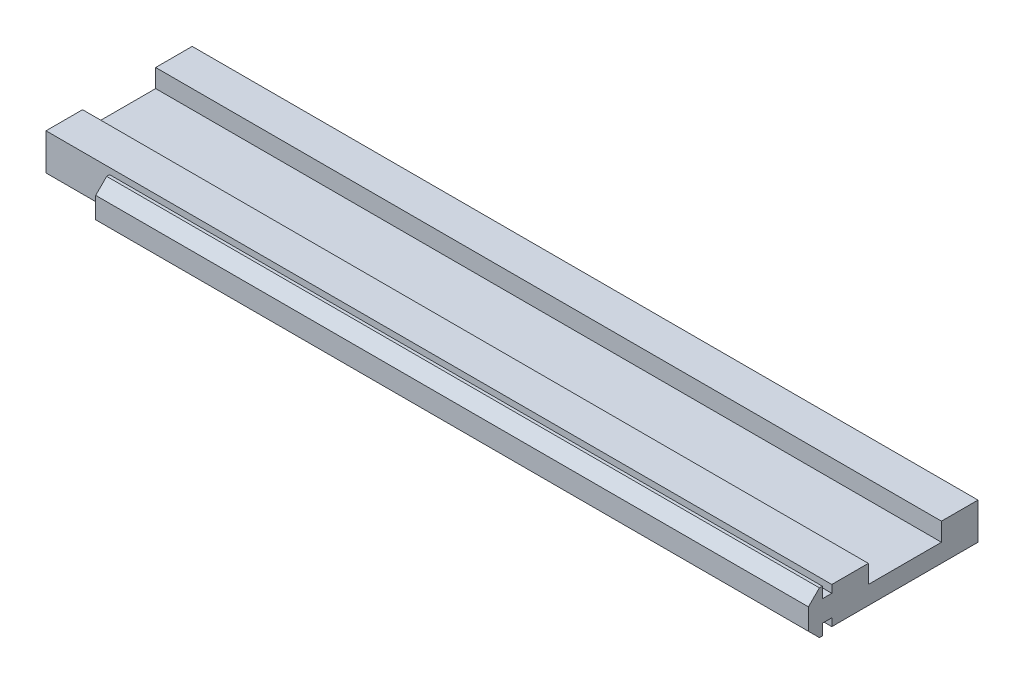
from build123d import *

# Parameters (mm, degrees)
SKETCH1_R           = 2.1
BOSS_EXTRUDE1_DEPTH = 65
SKETCH84_W          = 0.3
SKETCH84_H          = 5.4
BOSS_EXTRUDE6_DEPTH = 430
SKETCH85_W          = 26.589814492
SKETCH85_H          = 26.977421118
CUT_EXTRUDE59_DEPTH = 434.070721707
SKETCH86_W          = 10.5
SKETCH86_H          = 16.670499862
CUT_EXTRUDE60_DEPTH = 20
BOSS_EXTRUDE7_DEPTH = 430
SKETCH88_W          = 50.836385829
SKETCH88_H          = 23.143723533
CUT_EXTRUDE61_DEPTH = 452.123510754
SKETCH89_W          = 10.587528554
SKETCH89_H          = 18.486902418
CUT_EXTRUDE62_DEPTH = 20
SKETCH90_W          = 68.779191088
SKETCH90_H          = 30.058280779
CUT_EXTRUDE63_DEPTH = 215
BOSS_EXTRUDE8_DEPTH = 195


with BuildPart() as part:
    # Sketch1 → Boss-Extrude1 (new body)
    with BuildSketch(Plane(origin=(0, 0, 0), x_dir=(0, 0, -1), z_dir=(1, 0, 0))):
        with BuildLine():
            Line((-10, 9), (-10, 3))
            Line((-10, 3), (-8, 3))
            Line((-8, 3), (-8, 6))
            Line((-8, 6), (-7.060660172, 6))
            Line((-7.060660172, 6), (-4, 2.939339828))
            Line((-4, 2.939339828), (-4, -2.939339828))
            Line((-4, -2.939339828), (-7.060660172, -6))
            Line((-7.060660172, -6), (-8, -6))
            Line((-8, -6), (-8, -3))
            Line((-8, -3), (-10, -3))
            Line((-10, -3), (-10, -9))
            ThreePointArc((-10, -9), (-9.707106781, -9.707106781), (-9, -10))
            Line((-9, -10), (-3, -10))
            Line((-3, -10), (-3, -8))
            Line((-3, -8), (-6, -8))
            Line((-6, -8), (-6, -7.060660172))
            Line((-6, -7.060660172), (-2.939339828, -4))
            Line((-2.939339828, -4), (2.939339828, -4))
            Line((2.939339828, -4), (6, -7.060660172))
            Line((6, -7.060660172), (6, -8))
            Line((6, -8), (3, -8))
            Line((3, -8), (3, -10))
            Line((3, -10), (9, -10))
            ThreePointArc((9, -10), (9.707106781, -9.707106781), (10, -9))
            Line((10, -9), (10, -3))
            Line((10, -3), (8, -3))
            Line((8, -3), (8, -6))
            Line((8, -6), (7.060660172, -6))
            Line((7.060660172, -6), (4, -2.939339828))
            Line((4, -2.939339828), (4, 2.939339828))
            Line((4, 2.939339828), (7.060660172, 6))
            Line((7.060660172, 6), (8, 6))
            Line((8, 6), (8, 3))
            Line((8, 3), (10, 3))
            Line((10, 3), (10, 9))
            ThreePointArc((10, 9), (9.707106781, 9.707106781), (9, 10))
            Line((9, 10), (3, 10))
            Line((3, 10), (3, 8))
            Line((3, 8), (6, 8))
            Line((6, 8), (6, 7.060660172))
            Line((6, 7.060660172), (2.939339828, 4))
            Line((2.939339828, 4), (-2.939339828, 4))
            Line((-2.939339828, 4), (-6, 7.060660172))
            Line((-6, 7.060660172), (-6, 8))
            Line((-6, 8), (-3, 8))
            Line((-3, 8), (-3, 10))
            Line((-3, 10), (-9, 10))
            ThreePointArc((-9, 10), (-9.707106781, 9.707106781), (-10, 9))
        make_face()
        Circle(SKETCH1_R, mode=Mode.SUBTRACT)
    extrude(amount=BOSS_EXTRUDE1_DEPTH)

    # Sketch85 → Cut-Extrude59 (cut, through all)
    with BuildSketch(Plane(origin=(65, 0, 0), x_dir=(0, 0, -1), z_dir=(1, 0, 0))):
        with Locations((1.176321583, -0.814927094)):
            Rectangle(SKETCH85_W, SKETCH85_H)
    extrude(amount=-CUT_EXTRUDE59_DEPTH, mode=Mode.SUBTRACT)


with BuildPart() as body_2:
    # Sketch84 → Boss-Extrude6 (new body)
    with BuildSketch(Plane(origin=(65, 0, 0), x_dir=(0, 0, -1), z_dir=(1, 0, 0))):
        Polygon((-10, -2.7), (-10, 2.7), (-10.5, 2.7), (-10.5, 5), (-20.5, 5), (-20.5, 0), (-40.5, 0), (-40.5, 5), (-50.5, 5), (-50.5, -5), (-10.5, -5), (-10.5, -2.7), align=None)
        Polygon((-7.18492424, 5.7), (-4.3, 2.81507576), (-4.3, -2.81507576), (-7.18492424, -5.7), (-7.7, -5.7), (-7.7, -2.7), (-9.7, -2.7), (-9.7, 2.7), (-7.7, 2.7), (-7.7, 5.7), align=None)
        with Locations((-9.85, 0)):
            Rectangle(SKETCH84_W, SKETCH84_H)
    extrude(amount=BOSS_EXTRUDE6_DEPTH)

    # Sketch86 → Cut-Extrude60 (cut)
    with BuildSketch(Plane.ZY.offset(-65)):
        with Locations((5.25, -0.117074477)):
            Rectangle(SKETCH86_W, SKETCH86_H)
    extrude(amount=-CUT_EXTRUDE60_DEPTH, mode=Mode.SUBTRACT)

    # Sketch88 → Cut-Extrude61 (cut, through all)
    with BuildSketch(Plane(origin=(495, 0, 0), x_dir=(0, 0, -1), z_dir=(1, 0, 0))):
        with Locations((-27.072054747, -2.705254768)):
            Rectangle(SKETCH88_W, SKETCH88_H)
    extrude(amount=-CUT_EXTRUDE61_DEPTH, mode=Mode.SUBTRACT)


with BuildPart() as body_2_2:
    # Sketch87 → Boss-Extrude7 (new body)
    with BuildSketch(Plane(origin=(495, 0, 0), x_dir=(0, 0, -1), z_dir=(1, 0, 0))):
        Polygon((-90.108224091, 5), (-90.108224091, -5), (-130.108224091, -5), (-130.108224091, -2.7), (-132.908224091, -2.7), (-132.908224091, -5.7), (-133.42329985, -5.7), (-136.308224091, -2.81507576), (-136.308224091, 2.81507576), (-133.42329985, 5.7), (-132.908224091, 5.7), (-132.908224091, 2.7), (-130.108224091, 2.7), (-130.108224091, 5), (-120.108224091, 5), (-120.108224091, 0), (-100.108224091, 0), (-100.108224091, 5), align=None)
    extrude(amount=BOSS_EXTRUDE7_DEPTH)

    # Sketch89 → Cut-Extrude62 (cut)
    with BuildSketch(Plane.ZY.offset(-495)):
        with Locations((135.401988368, 0.001330813)):
            Rectangle(SKETCH89_W, SKETCH89_H)
    extrude(amount=-CUT_EXTRUDE62_DEPTH, mode=Mode.SUBTRACT)

    # Sketch90 → Cut-Extrude63 (cut)
    with BuildSketch(Plane(origin=(925, 0, 0), x_dir=(0, 0, -1), z_dir=(1, 0, 0))):
        with Locations((-108.68522288, -2.394915258)):
            Rectangle(SKETCH90_W, SKETCH90_H)
    extrude(amount=-CUT_EXTRUDE63_DEPTH, mode=Mode.SUBTRACT)

    # Sketch91 → Boss-Extrude8 (add)
    with BuildSketch(Plane(origin=(710, 0, 0), x_dir=(0, 0, -1), z_dir=(1, 0, 0))):
        Polygon((-129.908224091, 2.9), (-129.908224091, -2.9), (-132.708224091, -2.9), (-132.708224091, -5.9), (-133.506142563, -5.9), (-136.508224091, -2.897918472), (-136.508224091, 2.897918472), (-133.506142563, 5.9), (-132.708224091, 5.9), (-132.708224091, 2.9), align=None)
        Polygon((-130.108224091, 2.7), (-130.108224091, -2.7), (-132.908224091, -2.7), (-132.908224091, -5.7), (-133.42329985, -5.7), (-136.308224091, -2.81507576), (-136.308224091, 2.81507576), (-133.42329985, 5.7), (-132.908224091, 5.7), (-132.908224091, 2.7), align=None, mode=Mode.SUBTRACT)
    extrude(amount=-BOSS_EXTRUDE8_DEPTH)


solid = body_2_2.part
